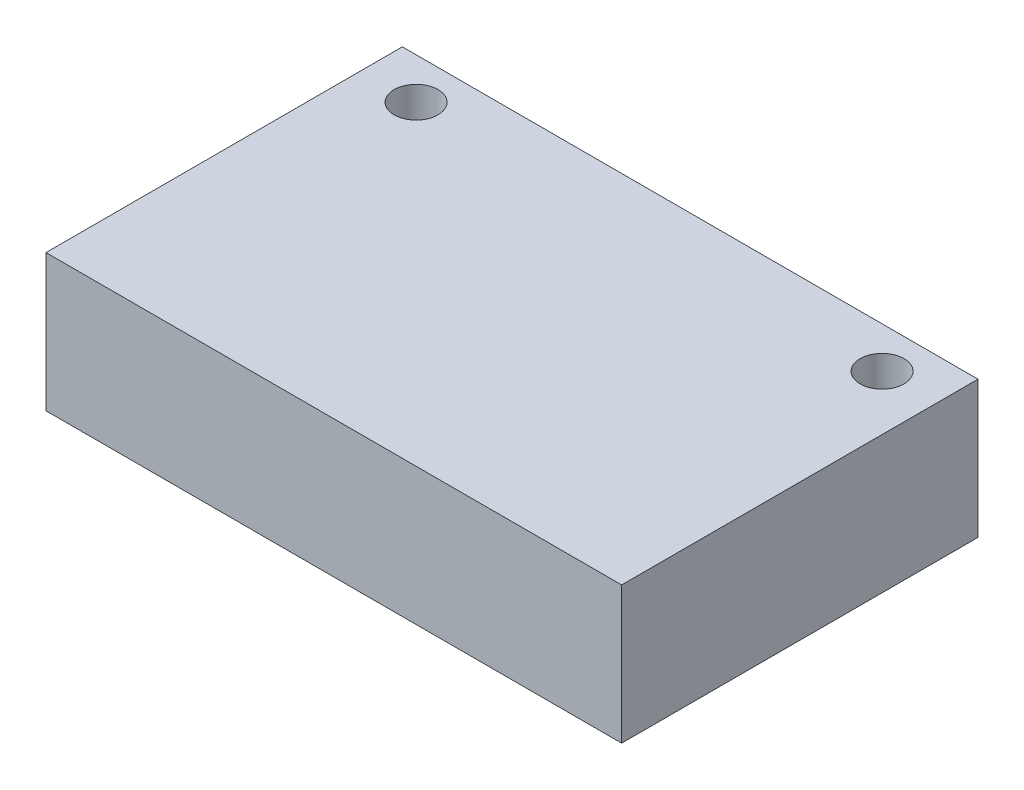
from build123d import *

# Parameters (mm, degrees)
CROQUIS2_W              = 42
CROQUIS2_H              = 26
CROQUIS2_R              = 1.6
SALIENTE_EXTRUIR1_DEPTH = 10


with BuildPart() as part:
    # Croquis2 → Saliente-Extruir1 (new body)
    with BuildSketch(Plane(origin=(0, 0, 0), x_dir=(1, 0, 0), z_dir=(0, 1, 0))):
        Rectangle(CROQUIS2_W, CROQUIS2_H)
        with Locations(Location((-17, 10, 0), (0, 0, 270))):
            Circle(CROQUIS2_R, mode=Mode.SUBTRACT)
        with Locations(Location((17, 10, 0), (0, 0, 270))):
            Circle(CROQUIS2_R, mode=Mode.SUBTRACT)
    extrude(amount=SALIENTE_EXTRUIR1_DEPTH)


solid = part.part
